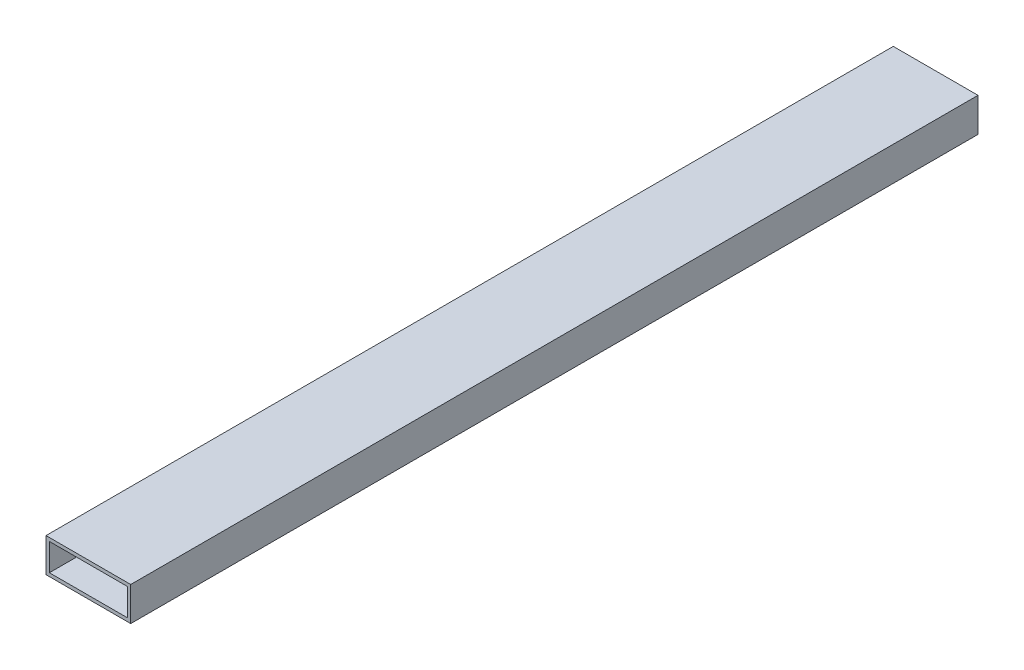
from build123d import *

# Parameters (mm, degrees)
SKETCH_1_W      = 50
SKETCH_1_H      = 20
SKETCH_1_W_2    = 46
SKETCH_1_H_2    = 16
EXTRUDE_1_DEPTH = 500


with BuildPart() as part:
    # Эскиз1 → Бобышка-Вытянуть1 (new body)
    with BuildSketch(Plane.XY):
        with Locations((25, 10)):
            Rectangle(SKETCH_1_W, SKETCH_1_H)
        with Locations((25, 10)):
            Rectangle(SKETCH_1_W_2, SKETCH_1_H_2, mode=Mode.SUBTRACT)
    extrude(amount=EXTRUDE_1_DEPTH)


solid = part.part
